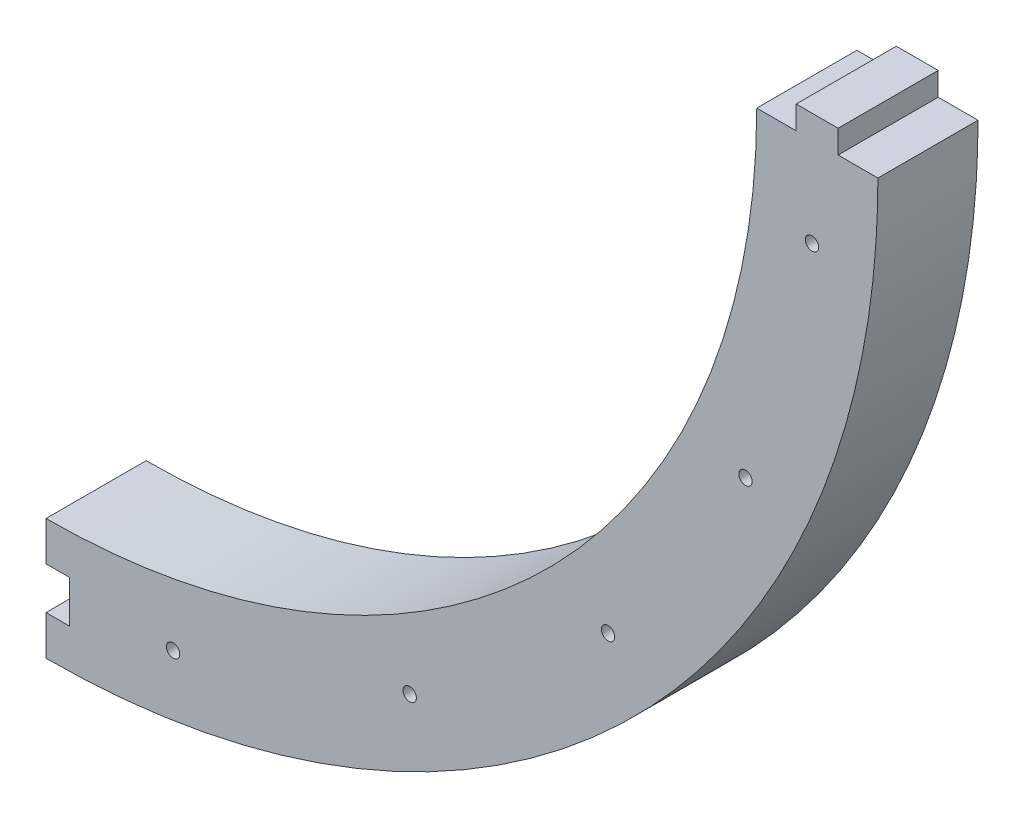
from build123d import *

# Parameters (mm, degrees)
BOSS_EXTRUDE1_DEPTH = 19.05
SKETCH2_R           = 1.27
CUT_EXTRUDE1_DEPTH  = 19.05


with BuildPart() as part:
    # Model → Boss-Extrude1 (new body)
    with BuildSketch(Plane.XY):
        with BuildLine():
            Line((152.231072356, -4.329633855), (152.231072356, -8.748222957))
            Line((152.231072356, -8.748222957), (144.734199957, -8.748222957))
            add(Edge.make_bspline(
                [(144.734199957, -8.748222957), (144.69301384, -83.417421729), (84.173632038, -143.939163421), (9.504929576, -143.982778331)],
                knots=[2, 2, 2, 2, 3, 3, 3, 3], degree=3))
            Line((9.504929576, -143.982778331), (9.504929576, -151.455509223))
            Line((9.504929576, -151.455509223), (13.947661262, -151.455509223))
            Line((13.947661262, -151.455509223), (13.947661262, -159.476656261))
            Line((13.947661262, -159.476656261), (9.504930652, -159.476656261))
            Line((9.504930652, -159.476656261), (9.504930652, -167.019727391))
            add(Edge.make_bspline(
                [(9.504930652, -167.019727391), (96.915292045, -167.019727391), (167.775395098, -96.159159251), (167.775412323, -8.748222419)],
                knots=[8, 8, 8, 8, 9, 9, 9, 9], degree=3))
            Line((167.775412323, -8.748222419), (160.207105868, -8.748222419))
            Line((160.207105868, -8.748222419), (160.207105868, -4.329633855))
            Line((160.207105868, -4.329633855), (152.231072356, -4.329633855))
        make_face()
    extrude(amount=BOSS_EXTRUDE1_DEPTH)

    # Sketch2 → Cut-Extrude1 (cut)
    with BuildSketch(Plane.XY.offset(19.05)):
        with Locations((116.443171089, -109.418222003)):
            Circle(SKETCH2_R)
        with Locations((78.695888831, -138.326762479)):
            Circle(SKETCH2_R)
        with Locations((33.680828367, -153.63053201)):
            Circle(SKETCH2_R)
        with Locations((142.586331098, -70.737364147)):
            Circle(SKETCH2_R)
        with Locations((155.238286937, -25.797386475)):
            Circle(SKETCH2_R)
    extrude(amount=-CUT_EXTRUDE1_DEPTH, mode=Mode.SUBTRACT)


solid = part.part
